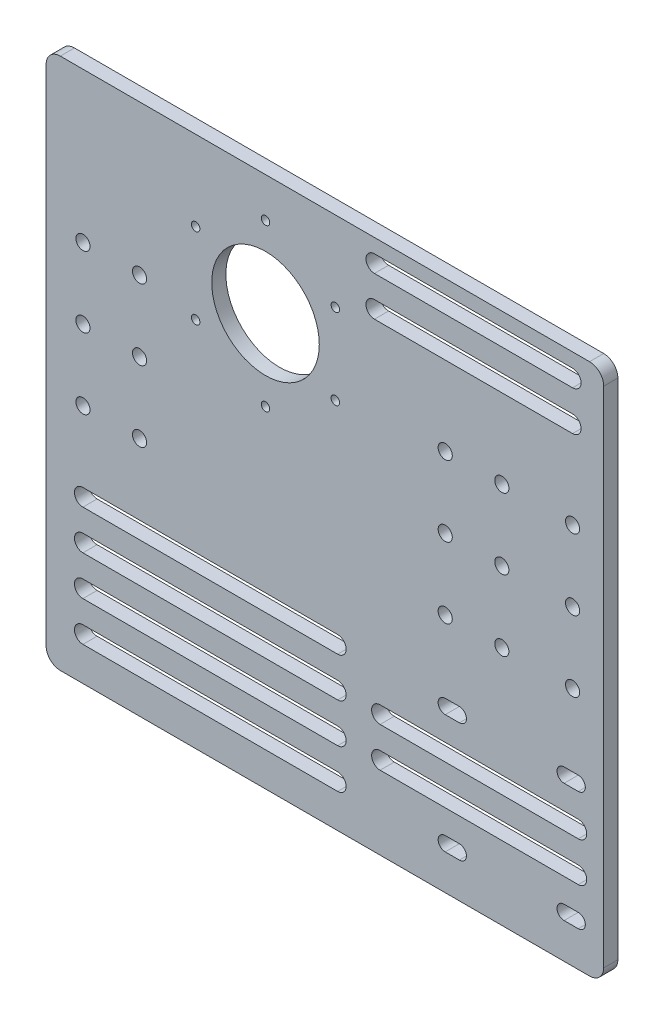
from build123d import *

# Parameters (mm, degrees)
SKETCH_1_R      = 2.5
SKETCH_1_R_2    = 1.5
SKETCH_1_R_3    = 19
EXTRUDE_1_DEPTH = 5
FILLET_1_R      = 5


with BuildPart() as part:
    # 草图1 → 凸台-拉伸1 (new body)
    with BuildSketch(Plane.XY):
        Polygon((-86, 75), (-86, -75), (86, -75), (111, -75), (111, 75), (111, 113), (-86, 113), align=None)
        with Locations((-73, 60)):
            Circle(SKETCH_1_R, mode=Mode.SUBTRACT)
        with Locations((-53, 60)):
            Circle(SKETCH_1_R, mode=Mode.SUBTRACT)
        with Locations((-73, 35)):
            Circle(SKETCH_1_R, mode=Mode.SUBTRACT)
        with Locations(Location((-53, 10, 0), (0, 0, 180))):
            Circle(SKETCH_1_R, mode=Mode.SUBTRACT)
        with Locations(Location((-73, 10, 0), (0, 0, 180))):
            Circle(SKETCH_1_R, mode=Mode.SUBTRACT)
        with Locations((75, 60)):
            Circle(SKETCH_1_R, mode=Mode.SUBTRACT)
        with Locations((75, 35)):
            Circle(SKETCH_1_R, mode=Mode.SUBTRACT)
        with Locations((75, 10)):
            Circle(SKETCH_1_R, mode=Mode.SUBTRACT)
        with Locations((55, 60)):
            Circle(SKETCH_1_R, mode=Mode.SUBTRACT)
        with Locations((55, 35)):
            Circle(SKETCH_1_R, mode=Mode.SUBTRACT)
        with Locations((55, 10)):
            Circle(SKETCH_1_R, mode=Mode.SUBTRACT)
        with Locations((-53, 35)):
            Circle(SKETCH_1_R, mode=Mode.SUBTRACT)
        with Locations((100, 60)):
            Circle(SKETCH_1_R, mode=Mode.SUBTRACT)
        with Locations((100, 35)):
            Circle(SKETCH_1_R, mode=Mode.SUBTRACT)
        with Locations((100, 10)):
            Circle(SKETCH_1_R, mode=Mode.SUBTRACT)
        with Locations((-8.5, 99)):
            Circle(SKETCH_1_R_2, mode=Mode.SUBTRACT)
        with Locations((16.181724008, 84.75)):
            Circle(SKETCH_1_R_2, mode=Mode.SUBTRACT)
        with Locations((16.181724008, 56.25)):
            Circle(SKETCH_1_R_2, mode=Mode.SUBTRACT)
        with Locations((-8.5, 42)):
            Circle(SKETCH_1_R_2, mode=Mode.SUBTRACT)
        with Locations((-33.181724008, 56.25)):
            Circle(SKETCH_1_R_2, mode=Mode.SUBTRACT)
        with Locations((-33.181724008, 84.75)):
            Circle(SKETCH_1_R_2, mode=Mode.SUBTRACT)
        with Locations((-8.5, 70.5)):
            Circle(SKETCH_1_R_3, mode=Mode.SUBTRACT)
        with BuildLine():
            Line((55, -15.5), (60, -15.5))
            ThreePointArc((60, -15.5), (62.5, -18), (60, -20.5))
            Line((60, -20.5), (55, -20.5))
            ThreePointArc((55, -20.5), (52.5, -18), (55, -15.5))
        make_face(mode=Mode.SUBTRACT)
        with BuildLine():
            Line((55, -57.5), (60, -57.5))
            ThreePointArc((60, -57.5), (62.5, -60), (60, -62.5))
            Line((60, -62.5), (55, -62.5))
            ThreePointArc((55, -62.5), (52.5, -60), (55, -57.5))
        make_face(mode=Mode.SUBTRACT)
        with BuildLine():
            Line((97, -15.5), (102, -15.5))
            ThreePointArc((102, -15.5), (104.5, -18), (102, -20.5))
            Line((102, -20.5), (97, -20.5))
            ThreePointArc((97, -20.5), (94.5, -18), (97, -15.5))
        make_face(mode=Mode.SUBTRACT)
        with BuildLine():
            Line((97, -57.5), (102, -57.5))
            ThreePointArc((102, -57.5), (104.5, -60), (102, -62.5))
            Line((102, -62.5), (97, -62.5))
            ThreePointArc((97, -62.5), (94.5, -60), (97, -57.5))
        make_face(mode=Mode.SUBTRACT)
        with BuildLine():
            Line((-73, -15), (17, -15))
            ThreePointArc((17, -15), (20, -18), (17, -21))
            Line((17, -21), (-73, -21))
            ThreePointArc((-73, -21), (-76, -18), (-73, -15))
        make_face(mode=Mode.SUBTRACT)
        with BuildLine():
            Line((-73, -57), (17, -57))
            ThreePointArc((17, -57), (20, -60), (17, -63))
            Line((17, -63), (-73, -63))
            ThreePointArc((-73, -63), (-76, -60), (-73, -57))
        make_face(mode=Mode.SUBTRACT)
        with BuildLine():
            Line((-73, -29), (17, -29))
            ThreePointArc((17, -29), (20, -32), (17, -35))
            Line((17, -35), (-73, -35))
            ThreePointArc((-73, -35), (-76, -32), (-73, -29))
        make_face(mode=Mode.SUBTRACT)
        with BuildLine():
            Line((-73, -43), (17, -43))
            ThreePointArc((17, -43), (20, -46), (17, -49))
            Line((17, -49), (-73, -49))
            ThreePointArc((-73, -49), (-76, -46), (-73, -43))
        make_face(mode=Mode.SUBTRACT)
        with BuildLine():
            Line((100, 102), (30, 102))
            ThreePointArc((30, 102), (27, 105), (30, 108))
            Line((30, 108), (100, 108))
            ThreePointArc((100, 108), (103, 105), (100, 102))
        make_face(mode=Mode.SUBTRACT)
        with BuildLine():
            Line((100, 88), (30, 88))
            ThreePointArc((30, 88), (27, 91), (30, 94))
            Line((30, 94), (100, 94))
            ThreePointArc((100, 94), (103, 91), (100, 88))
        make_face(mode=Mode.SUBTRACT)
        with BuildLine():
            Line((102, -35), (32, -35))
            ThreePointArc((32, -35), (29, -32), (32, -29))
            Line((32, -29), (102, -29))
            ThreePointArc((102, -29), (105, -32), (102, -35))
        make_face(mode=Mode.SUBTRACT)
        with BuildLine():
            Line((102, -49), (32, -49))
            ThreePointArc((32, -49), (29, -46), (32, -43))
            Line((32, -43), (102, -43))
            ThreePointArc((102, -43), (105, -46), (102, -49))
        make_face(mode=Mode.SUBTRACT)
    extrude(amount=EXTRUDE_1_DEPTH)

    # 圆角1
    fillet_1_edges = [part.edges().sort_by_distance(p)[0] for p in [
        (-86, 113, 2.5),
        (111, 113, 2.5),
        (111, -75, 2.5),
        (-86, -75, 2.5),
    ]]
    fillet(fillet_1_edges, radius=FILLET_1_R)


solid = part.part
